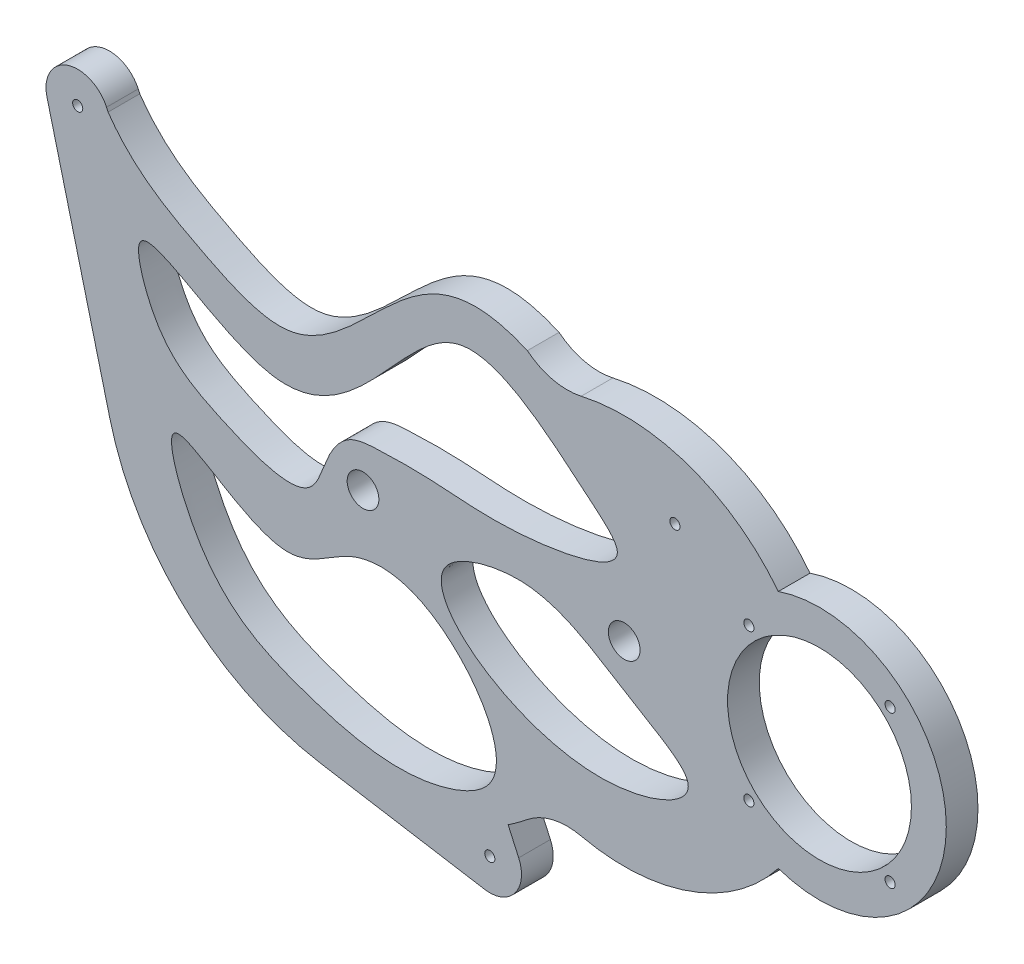
from build123d import *

# Parameters (mm, degrees)
SKETCH2_R           = 14.5
SKETCH2_R_2         = 2.5
SKETCH2_R_3         = 0.8
BOSS_EXTRUDE2_DEPTH = 5


with BuildPart() as part:
    # Sketch2 → Boss-Extrude2 (new body)
    with BuildSketch(Plane.XY):
        with BuildLine():
            Line((-90.193325726, 32.079590852), (-89.945424203, 31.537555981))
            add(Edge.make_bspline(
                [(-89.945424203, 31.537555981), (-85.962214557, 25.8015944), (-77.241214609, 20.848860508), (-60.771858644, 12.8687701), (-45.094939781, 27.552331652), (-35.711078315, 37.248863586), (-23.82002344, 32.024637389)],
                knots=[0, 0, 0, 0, 0.248036885, 0.436901522, 0.633305837, 1, 1, 1, 1], degree=3))
            ThreePointArc((-23.82002344, 32.024637389), (-19.800249752, 30.059024794), (-15.325658613, 30.043292034))
            ThreePointArc((-15.325658613, 30.043292034), (1.837485271, 28.998979756), (15.766157566, 18.916510604))
            ThreePointArc((15.766157566, 18.916510604), (42.25966406, 0), (15.766157566, -18.916510604))
            ThreePointArc((15.766157566, -18.916510604), (1.837485271, -28.998979756), (-15.325658613, -30.043292034))
            ThreePointArc((-15.325658613, -30.043292034), (-19.800249752, -30.059024794), (-23.82002344, -32.024637389))
            ThreePointArc((-23.82002344, -32.024637389), (-25.309762596, -33.175097378), (-26.850493016, -34.256314614))
            Line((-26.850493016, -34.256314614), (-25.184632505, -37.939522821))
            ThreePointArc((-25.184632505, -37.939522821), (-25.775044955, -43.045729372), (-30.556283388, -44.932973724))
            Line((-30.556283388, -44.932973724), (-56.463742912, -40.647703486))
            ThreePointArc((-56.463742912, -40.647703486), (-77.600660327, -30.35197399), (-89.664863308, -10.172124384))
            Line((-89.664863308, -10.172124384), (-97.19910421, 19.398985418))
            Line((-97.19910421, 19.398985418), (-99.585545572, 28.765518885))
            ThreePointArc((-99.585545572, 28.765518885), (-96.404066379, 34.715082293), (-90.193325726, 32.079590852))
        make_face()
        with Locations((22.25966406, 0)):
            Circle(SKETCH2_R, mode=Mode.SUBTRACT)
        with Locations((-49.74033594, 0)):
            Circle(SKETCH2_R_2, mode=Mode.SUBTRACT)
        with Locations((-8.54033594, 0)):
            Circle(SKETCH2_R_2, mode=Mode.SUBTRACT)
        with Locations((-94.74033594, 30)):
            Circle(SKETCH2_R_3, mode=Mode.SUBTRACT)
        with Locations((-29.74033594, -40)):
            Circle(SKETCH2_R_3, mode=Mode.SUBTRACT)
        with Locations((-0.54033594, 20)):
            Circle(SKETCH2_R_3, mode=Mode.SUBTRACT)
        with Locations((33.395682799, 11.971281746)):
            Circle(SKETCH2_R_3, mode=Mode.SUBTRACT)
        with Locations((11.12364532, 11.971281746)):
            Circle(SKETCH2_R_3, mode=Mode.SUBTRACT)
        with Locations((11.12364532, -11.971281746)):
            Circle(SKETCH2_R_3, mode=Mode.SUBTRACT)
        with Locations((33.395682799, -11.971281746)):
            Circle(SKETCH2_R_3, mode=Mode.SUBTRACT)
        with BuildLine():
            add(Edge.make_bspline(
                [(-64.14677111, 8.542882795), (-72.691043296, 9.990533922), (-88.737672646, 24.253466393), (-82.168043229, 3.712738616), (-72.910147541, -1.435963402), (-57.618374643, -7.466341579), (-55.623980591, 2.147310065), (-52.005785508, 6.515257988), (-46.74677052, 6.760189958), (-36.899425525, 7.015549494), (-27.074609888, 5.038408807), (-5.72214151, 9.622424808), (-19.12186337, 20.95523596), (-39.222912143, 38.317655339), (-50.617164041, 6.250569243), (-64.14677111, 8.542882795)],
                knots=[0, 0, 0, 0, 0.124196137, 0.17743275, 0.253962619, 0.332106801, 0.369145495, 0.395898758, 0.421744335, 0.453106213, 0.559647017, 0.637461705, 0.670003262, 0.803339022, 1, 1, 1, 1], degree=3))
        make_face(mode=Mode.SUBTRACT)
        with BuildLine():
            add(Edge.make_bspline(
                [(-79.555313804, -7.122798152), (-77.641520297, -5.256298746), (-62.917780903, -19.553264177), (-52.280186259, -8.68636038), (-36.961004884, -8.725033125), (-23.012748176, -28.460556734), (-42.038431722, -36.997306), (-59.096566594, -32.765807799), (-74.760058361, -25.567273346), (-80.937655925, -8.470979521), (-79.555313804, -7.122798152)],
                knots=[0, 0, 0, 0, 0.152444217, 0.23608519, 0.315356967, 0.495919363, 0.562728908, 0.736287467, 0.889888819, 1, 1, 1, 1], degree=3))
        make_face(mode=Mode.SUBTRACT)
        with BuildLine():
            add(Edge.make_bspline(
                [(-26.850493016, 0), (-30.431339856, -0.272767806), (-46.695741413, -5.300628399), (-18.872935214, -26.419288234), (6.871160969, -15.482435765), (-11.511539663, -5.559179954), (-18.970010873, 0.600288681), (-26.850493016, 0)],
                knots=[0, 0, 0, 0, 0.116637026, 0.45833096, 0.630209335, 0.743313233, 1, 1, 1, 1], degree=3))
        make_face(mode=Mode.SUBTRACT)
    extrude(amount=BOSS_EXTRUDE2_DEPTH)


solid = part.part
